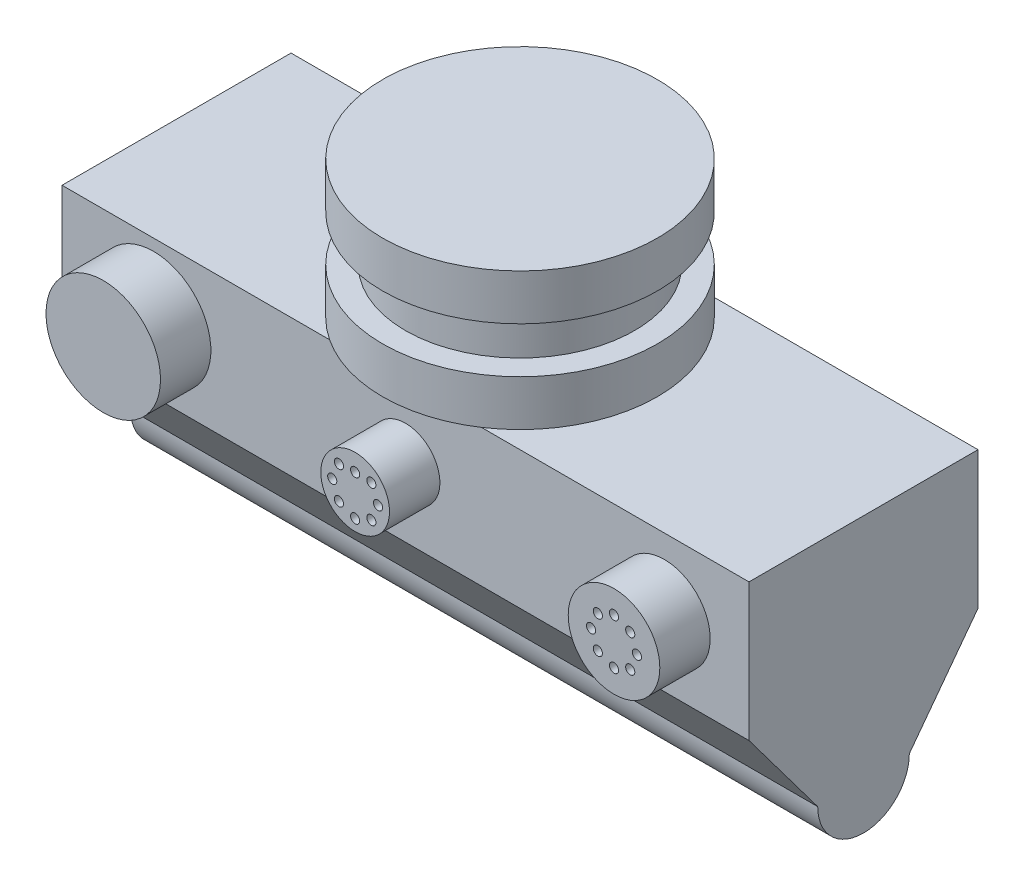
from build123d import *

# Parameters (mm, degrees)
SKIZZE1_W                       = 150
SKIZZE1_H                       = 50
AUFSATZ_LINEAR_AUSTRAGEN1_DEPTH = 50
SKIZZE2_R                       = 10
AUFSATZ_LINEAR_AUSTRAGEN2_DEPTH = 150
SCHNITT_LINEAR_AUSTRAGEN1_DEPTH = 182
SKIZZE4_R                       = 12.5
SKIZZE4_R_2                     = 10
SKIZZE4_R_3                     = 1
SKIZZE4_R_4                     = 7.5
AUFSATZ_LINEAR_AUSTRAGEN3_DEPTH = 11
SKIZZE5_R                       = 30
AUFSATZ_LINEAR_AUSTRAGEN4_DEPTH = 30
SCHNITT_LINEAR_START            = -20
SKIZZE6_R                       = 30
SKIZZE6_R_2                     = 25
SCHNITT_LINEAR_AUSTRAGEN3_DEPTH = 10


with BuildPart() as part:
    # Skizze1 → Aufsatz-Linear austragen1 (new body)
    with BuildSketch(Plane(origin=(0, 0, 0), x_dir=(1, 0, 0), z_dir=(0, 1, 0))):
        Rectangle(SKIZZE1_W, SKIZZE1_H)
    extrude(amount=AUFSATZ_LINEAR_AUSTRAGEN1_DEPTH)

    # Skizze2 → Aufsatz-Linear austragen2 (add)
    with BuildSketch(Plane(origin=(75, 0, 0), x_dir=(0, 0, -1), z_dir=(1, 0, 0))):
        Circle(SKIZZE2_R)
    extrude(amount=-AUFSATZ_LINEAR_AUSTRAGEN2_DEPTH)

    # Skizze3 → Schnitt-Linear austragen1 (cut)
    with BuildSketch(Plane(origin=(75, 0, 0), x_dir=(0, 0, -1), z_dir=(1, 0, 0))):
        Polygon((-10, 0), (-25, 20), (-25, 0), align=None)
        Polygon((25, 20), (25, 0), (10, 0), align=None)
    extrude(amount=-SCHNITT_LINEAR_AUSTRAGEN1_DEPTH, mode=Mode.SUBTRACT)

    # Skizze4 → Aufsatz-Linear austragen3 (add)
    # profile 1 of 3: a face of its own
    with BuildSketch(Plane.XY.offset(25)):
        with Locations(Location((-55, 35, 0), (0, 0, 180))):
            Circle(SKIZZE4_R)
    # profile 2 of 3: a face of its own
    with BuildSketch(Plane.XY.offset(25)):
        with Locations(Location((56.52620572, 35, 0), (0, 0, 180))):
            Circle(SKIZZE4_R_2)
        with Locations((56.52620572, 40)):
            Circle(SKIZZE4_R_3, mode=Mode.SUBTRACT)
        with Locations((60.061739626, 38.535533906)):
            Circle(SKIZZE4_R_3, mode=Mode.SUBTRACT)
        with Locations((61.52620572, 35)):
            Circle(SKIZZE4_R_3, mode=Mode.SUBTRACT)
        with Locations((60.061739626, 31.464466094)):
            Circle(SKIZZE4_R_3, mode=Mode.SUBTRACT)
        with Locations((56.52620572, 30)):
            Circle(SKIZZE4_R_3, mode=Mode.SUBTRACT)
        with Locations((52.990671814, 31.464466094)):
            Circle(SKIZZE4_R_3, mode=Mode.SUBTRACT)
        with Locations((51.52620572, 35)):
            Circle(SKIZZE4_R_3, mode=Mode.SUBTRACT)
        with Locations((52.990671814, 38.535533906)):
            Circle(SKIZZE4_R_3, mode=Mode.SUBTRACT)
    # profile 3 of 3: a face of its own
    with BuildSketch(Plane.XY.offset(25)):
        with Locations(Location((0, 35, 0), (0, 0, 180))):
            Circle(SKIZZE4_R_4)
        with Locations((0, 38.75)):
            Circle(SKIZZE4_R_3, mode=Mode.SUBTRACT)
        with Locations((3.535533906, 38.535533906)):
            Circle(SKIZZE4_R_3, mode=Mode.SUBTRACT)
        with Locations((5, 35)):
            Circle(SKIZZE4_R_3, mode=Mode.SUBTRACT)
        with Locations((3.535533906, 31.464466094)):
            Circle(SKIZZE4_R_3, mode=Mode.SUBTRACT)
        with Locations((0, 30)):
            Circle(SKIZZE4_R_3, mode=Mode.SUBTRACT)
        with Locations((-3.535533906, 31.464466094)):
            Circle(SKIZZE4_R_3, mode=Mode.SUBTRACT)
        with Locations((-5, 35)):
            Circle(SKIZZE4_R_3, mode=Mode.SUBTRACT)
        with Locations((-3.535533906, 38.535533906)):
            Circle(SKIZZE4_R_3, mode=Mode.SUBTRACT)
    extrude(amount=AUFSATZ_LINEAR_AUSTRAGEN3_DEPTH)

    # Skizze5 → Aufsatz-Linear austragen4 (add)
    with BuildSketch(Plane(origin=(0, 50, 0), x_dir=(1, 0, 0), z_dir=(0, 1, 0))):
        with Locations(Location((0, 0, 0), (0, 0, 56.442690238))):
            Circle(SKIZZE5_R)
    extrude(amount=AUFSATZ_LINEAR_AUSTRAGEN4_DEPTH)

    # Skizze6 → Schnitt-Linear austragen3 (cut)
    with BuildSketch(Plane(origin=(0, 80, 0), x_dir=(1, 0, 0), z_dir=(0, 1, 0)).offset(SCHNITT_LINEAR_START)):
        with Locations(Location((0, 0, 0), (0, 0, 56.442690238))):
            Circle(SKIZZE6_R)
        with Locations(Location((0, 0, 0), (0, 0, 270))):
            Circle(SKIZZE6_R_2, mode=Mode.SUBTRACT)
    extrude(amount=SCHNITT_LINEAR_AUSTRAGEN3_DEPTH, mode=Mode.SUBTRACT)


solid = part.part
